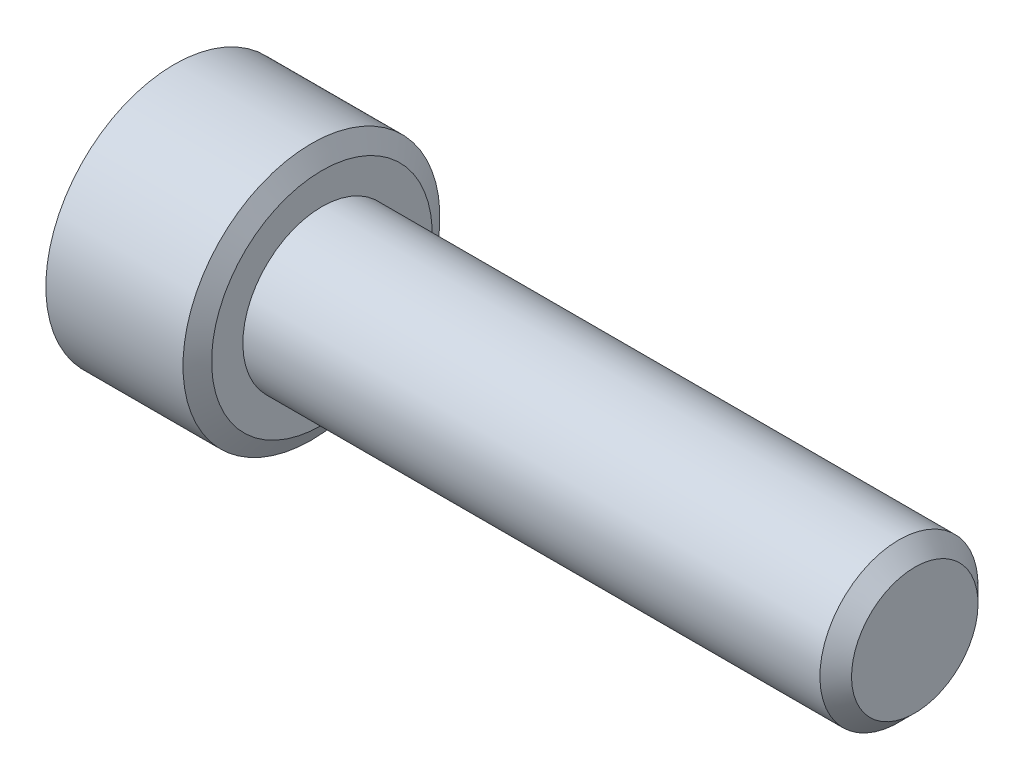
from build123d import *

# Parameters (mm, degrees)
CHAMFER1_SIZE      = 0.8
CUT_EXTRUDE1_DEPTH = 6


with BuildPart() as part:
    # Sketch1 → Revolve1 (revolve)
    with BuildSketch(Plane.XY):
        Polygon((0, 0), (0, 5.582013072), (0.53, 6.5), (7.47, 6.5), (8, 5.582013072), (8, 4), (38, 4), (38, 0), align=None)
    revolve(axis=Axis((38, 0, 0), (-1, 0, 0)))

    # Chamfer1
    chamfer1_edges = [part.edges().sort_by_distance(p)[0] for p in [
        (38, -4, 0),
    ]]
    chamfer(chamfer1_edges, length=CHAMFER1_SIZE)

    # Sketch2 → Cut-Extrude1 (cut)
    with BuildSketch(Plane.ZY):
        Polygon((3.75277675, 0), (1.876388375, 3.25), (-1.876388375, 3.25), (-3.75277675, 0), (-1.876388375, -3.25), (1.876388375, -3.25), align=None)
    extrude(amount=-CUT_EXTRUDE1_DEPTH, mode=Mode.SUBTRACT)

    # Sketch4 → Cut-Revolve1 (revolve, cut)
    with BuildSketch(Plane.XY, mode=Mode.PRIVATE) as cut_revolve1_sk:
        Polygon((0, 0), (0, 4), (2.309401077, 0), align=None)
        Polygon((6, 0), (6, 4), (8.309401077, 0), align=None)
    revolve(cut_revolve1_sk.sketch.rotate(Axis((0, 0, 0), (1, 0, 0)), 90), axis=Axis((0, 0, 0), (1, 0, 0)), mode=Mode.SUBTRACT)


solid = part.part
